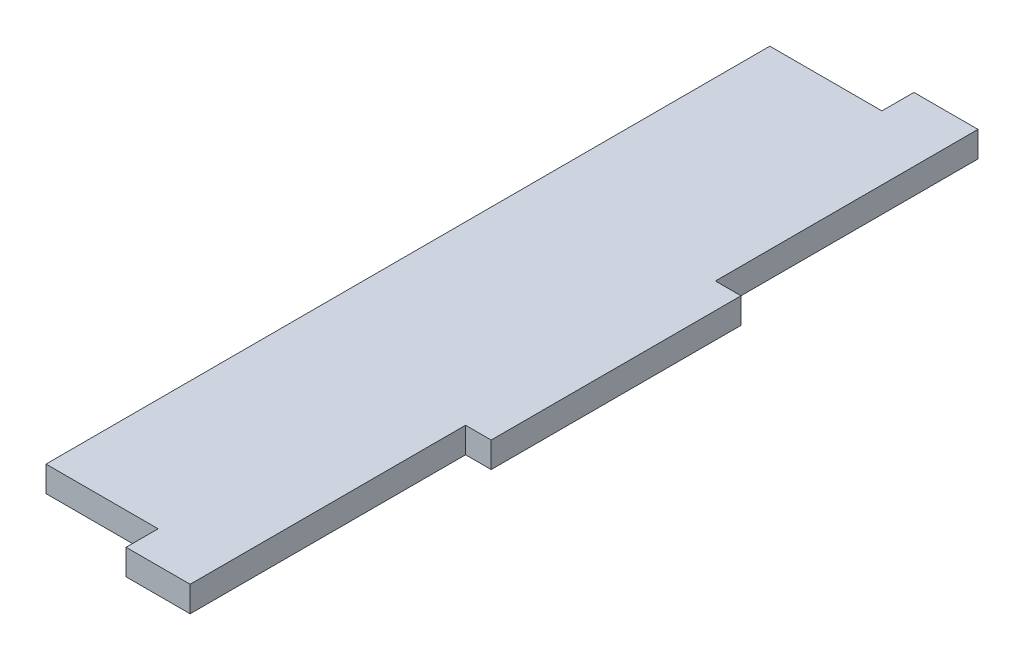
from build123d import *

# Parameters (mm, degrees)
BOSS_EXTRUDE1_DEPTH = 4
SKETCH2_W           = 10
SKETCH2_H           = 4
BOSS_EXTRUDE2_DEPTH = 4
SKETCH3_W           = 4
SKETCH3_H           = 39
BOSS_EXTRUDE3_DEPTH = 4


with BuildPart() as part:
    # Sketch1 → Boss-Extrude1 (new body)
    with BuildSketch(Plane(origin=(0, 0, 0), x_dir=(1, 0, 0), z_dir=(0, 1, 0))):
        Polygon((17.5, 113), (17.5, 114), (27.5, 114), (27.5, -1), (17.5, -1), (17.5, 0), (0, 0), (0, 113), align=None)
    extrude(amount=BOSS_EXTRUDE1_DEPTH)

    # Sketch2 → Boss-Extrude2 (add)
    with BuildSketch(Plane(origin=(0, 4, 0), x_dir=(1, 0, 0), z_dir=(0, 1, 0))):
        with Locations((22.5, -3)):
            Rectangle(SKETCH2_W, SKETCH2_H)
        with Locations((22.5, 116)):
            Rectangle(SKETCH2_W, SKETCH2_H)
    extrude(amount=-BOSS_EXTRUDE2_DEPTH)

    # Sketch3 → Boss-Extrude3 (add)
    with BuildSketch(Plane(origin=(0, 4, 0), x_dir=(1, 0, 0), z_dir=(0, 1, 0))):
        with Locations((29.5, 57.5)):
            Rectangle(SKETCH3_W, SKETCH3_H)
    extrude(amount=-BOSS_EXTRUDE3_DEPTH)


solid = part.part
